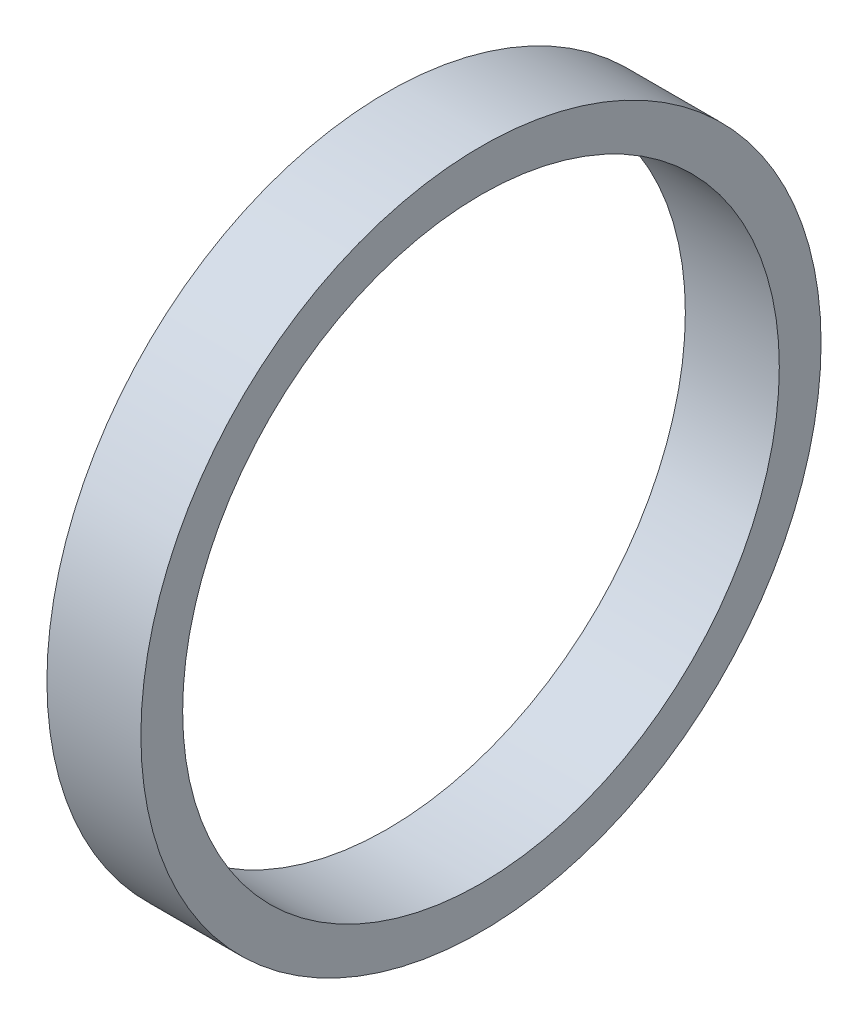
from build123d import *

# Parameters (mm, degrees)
SKETCH1_R           = 3.6195
SKETCH1_R_2         = 3.175
BOSS_EXTRUDE1_DEPTH = 1


with BuildPart() as part:
    # Sketch1 → Boss-Extrude1 (new body)
    with BuildSketch(Plane(origin=(0, 0, 0), x_dir=(0, 0, -1), z_dir=(1, 0, 0))):
        Circle(SKETCH1_R)
        Circle(SKETCH1_R_2, mode=Mode.SUBTRACT)
    extrude(amount=BOSS_EXTRUDE1_DEPTH)


solid = part.part
